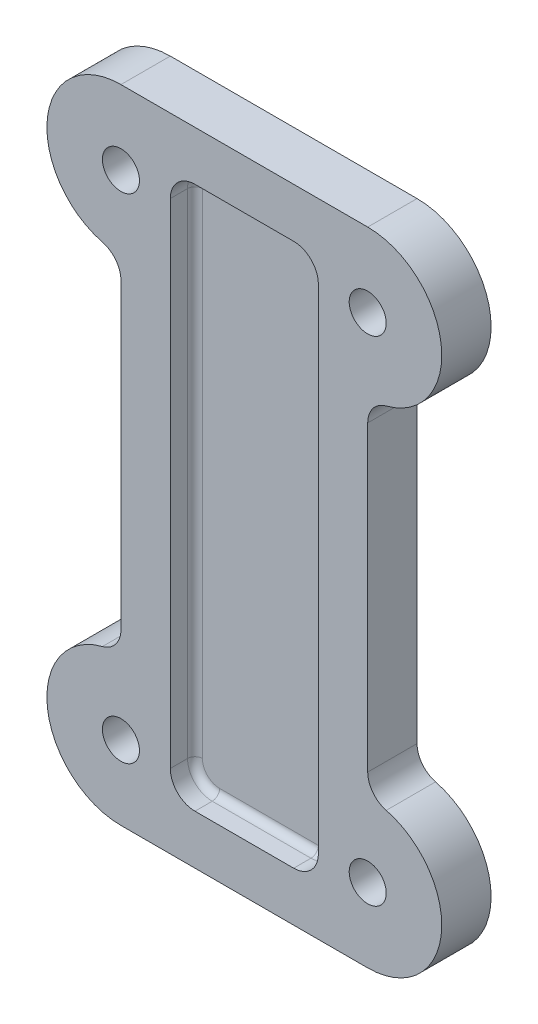
from build123d import *

# Parameters (mm, degrees)
BOSS_EXTRUDE1_DEPTH = 3.175
BOSS_EXTRUDE2_DEPTH = 3.175
FILLET1_R           = 0.9525


with BuildPart() as part:
    # Sketch1 → Boss-Extrude1 (new body)
    with BuildSketch(Plane.XY):
        with BuildLine():
            Line((15.875, 41.275), (-15.875, 41.275))
            ThreePointArc((-15.875, 41.275), (-25.324082857, 32.950190886), (-18.25625, 22.527458407))
            ThreePointArc((-18.25625, 22.527458407), (-16.539942107, 21.397560359), (-15.875, 19.453277876))
            Line((-15.875, 19.453277876), (-15.875, -19.453277876))
            ThreePointArc((-15.875, -19.453277876), (-16.539942107, -21.397560359), (-18.25625, -22.527458407))
            ThreePointArc((-18.25625, -22.527458407), (-25.324082857, -32.950190886), (-15.875, -41.275))
            Line((-15.875, -41.275), (15.875, -41.275))
            ThreePointArc((15.875, -41.275), (25.324082857, -32.950190886), (18.25625, -22.527458407))
            ThreePointArc((18.25625, -22.527458407), (16.539942107, -21.397560359), (15.875, -19.453277876))
            Line((15.875, -19.453277876), (15.875, 19.453277876))
            ThreePointArc((15.875, 19.453277876), (16.539942107, 21.397560359), (18.25625, 22.527458407))
            ThreePointArc((18.25625, 22.527458407), (25.324082857, 32.950190886), (15.875, 41.275))
        make_face()
        with BuildLine():
            ThreePointArc((-13.49375, -31.75), (-14.191201977, -33.433798023), (-15.875, -34.13125))
            ThreePointArc((-15.875, -34.13125), (-18.25625, -31.75), (-15.875, -29.36875))
            ThreePointArc((-15.875, -29.36875), (-14.191201977, -30.066201977), (-13.49375, -31.75))
        make_face(mode=Mode.SUBTRACT)
        with BuildLine():
            ThreePointArc((18.25625, -31.75), (17.558798023, -33.433798023), (15.875, -34.13125))
            ThreePointArc((15.875, -34.13125), (13.49375, -31.75), (15.875, -29.36875))
            ThreePointArc((15.875, -29.36875), (17.558798023, -30.066201977), (18.25625, -31.75))
        make_face(mode=Mode.SUBTRACT)
        with BuildLine():
            ThreePointArc((-13.49375, 31.75), (-14.191201977, 30.066201977), (-15.875, 29.36875))
            ThreePointArc((-15.875, 29.36875), (-18.25625, 31.75), (-15.875, 34.13125))
            ThreePointArc((-15.875, 34.13125), (-14.191201977, 33.433798023), (-13.49375, 31.75))
        make_face(mode=Mode.SUBTRACT)
        with BuildLine():
            ThreePointArc((15.875, 29.36875), (13.49375, 31.75), (15.875, 34.13125))
            ThreePointArc((15.875, 34.13125), (17.558798023, 33.433798023), (18.25625, 31.75))
            ThreePointArc((18.25625, 31.75), (17.558798023, 30.066201977), (15.875, 29.36875))
        make_face(mode=Mode.SUBTRACT)
    extrude(amount=BOSS_EXTRUDE1_DEPTH)

    # Sketch2 → Boss-Extrude2 (add)
    with BuildSketch(Plane.XY.offset(3.175)):
        with BuildLine():
            ThreePointArc((-18.25625, -22.527458407), (-25.324082857, -32.950190886), (-15.875, -41.275))
            Line((-15.875, -41.275), (15.875, -41.275))
            ThreePointArc((15.875, -41.275), (25.324082857, -32.950190886), (18.25625, -22.527458407))
            ThreePointArc((18.25625, -22.527458407), (16.539942107, -21.397560359), (15.875, -19.453277876))
            Line((15.875, -19.453277876), (15.875, 19.453277876))
            ThreePointArc((15.875, 19.453277876), (16.539942107, 21.397560359), (18.25625, 22.527458407))
            ThreePointArc((18.25625, 22.527458407), (25.324082857, 32.950190886), (15.875, 41.275))
            Line((15.875, 41.275), (-15.875, 41.275))
            ThreePointArc((-15.875, 41.275), (-25.324082857, 32.950190886), (-18.25625, 22.527458407))
            ThreePointArc((-18.25625, 22.527458407), (-16.539942107, 21.397560359), (-15.875, 19.453277876))
            Line((-15.875, 19.453277876), (-15.875, -19.453277876))
            ThreePointArc((-15.875, -19.453277876), (-16.539942107, -21.397560359), (-18.25625, -22.527458407))
        make_face()
        with BuildLine():
            ThreePointArc((-15.875, -34.13125), (-18.25625, -31.75), (-15.875, -29.36875))
            ThreePointArc((-15.875, -29.36875), (-14.191201977, -30.066201977), (-13.49375, -31.75))
            ThreePointArc((-13.49375, -31.75), (-14.191201977, -33.433798023), (-15.875, -34.13125))
        make_face(mode=Mode.SUBTRACT)
        with BuildLine():
            ThreePointArc((18.25625, -31.75), (17.558798023, -33.433798023), (15.875, -34.13125))
            ThreePointArc((15.875, -34.13125), (13.49375, -31.75), (15.875, -29.36875))
            ThreePointArc((15.875, -29.36875), (17.558798023, -30.066201977), (18.25625, -31.75))
        make_face(mode=Mode.SUBTRACT)
        with BuildLine():
            ThreePointArc((-9.525, 31.75), (-8.59506403, 33.99506403), (-6.35, 34.925))
            Line((-6.35, 34.925), (6.35, 34.925))
            ThreePointArc((6.35, 34.925), (8.59506403, 33.99506403), (9.525, 31.75))
            Line((9.525, 31.75), (9.525, -31.75))
            ThreePointArc((9.525, -31.75), (8.59506403, -33.99506403), (6.35, -34.925))
            Line((6.35, -34.925), (-6.35, -34.925))
            ThreePointArc((-6.35, -34.925), (-8.59506403, -33.99506403), (-9.525, -31.75))
            Line((-9.525, -31.75), (-9.525, 31.75))
        make_face(mode=Mode.SUBTRACT)
        with BuildLine():
            ThreePointArc((-15.875, 29.36875), (-18.25625, 31.75), (-15.875, 34.13125))
            ThreePointArc((-15.875, 34.13125), (-14.191201977, 33.433798023), (-13.49375, 31.75))
            ThreePointArc((-13.49375, 31.75), (-14.191201977, 30.066201977), (-15.875, 29.36875))
        make_face(mode=Mode.SUBTRACT)
        with BuildLine():
            ThreePointArc((15.875, 29.36875), (13.49375, 31.75), (15.875, 34.13125))
            ThreePointArc((15.875, 34.13125), (17.558798023, 33.433798023), (18.25625, 31.75))
            ThreePointArc((18.25625, 31.75), (17.558798023, 30.066201977), (15.875, 29.36875))
        make_face(mode=Mode.SUBTRACT)
    extrude(amount=BOSS_EXTRUDE2_DEPTH)

    # Fillet1
    fillet1_edges = [part.edges().sort_by_distance(p)[0] for p in [
        (0, 34.925, 3.175),
        (8.59506403, 33.99506403, 3.175),
        (9.525, 0, 3.175),
        (-8.59506403, -33.99506403, 3.175),
        (-8.59506403, 33.99506403, 3.175),
        (-9.525, 0, 3.175),
        (0, -34.925, 3.175),
        (8.59506403, -33.99506403, 3.175),
    ]]
    fillet(fillet1_edges, radius=FILLET1_R)


solid = part.part
